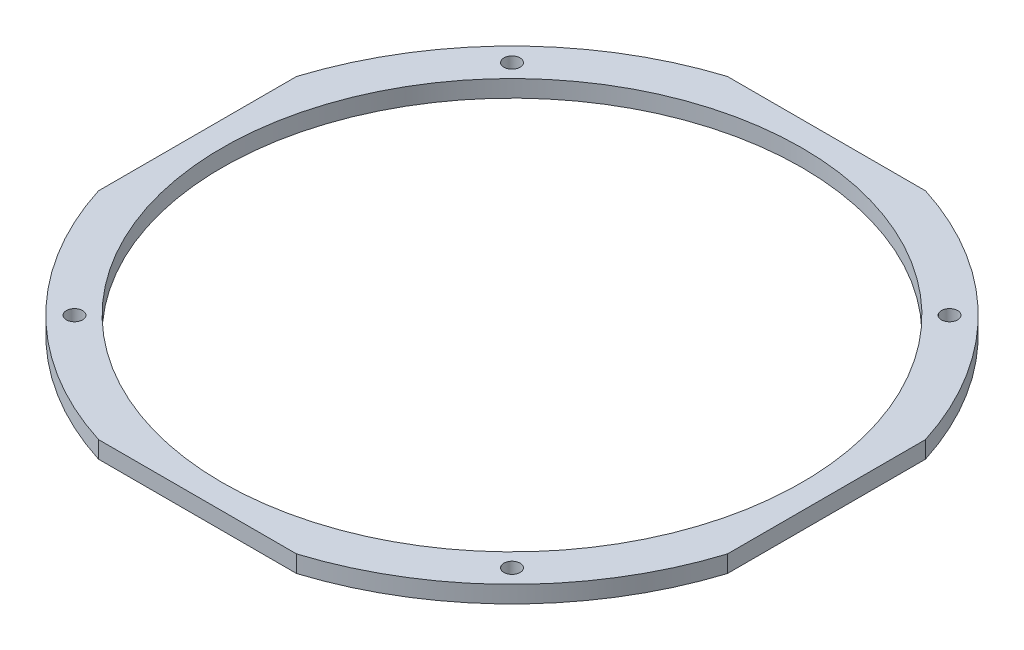
from build123d import *

# Parameters (mm, degrees)
SKETCH_1_R          = 65
SKETCH_1_R_2        = 57.15
EXTRUDE_1_DEPTH     = 3.35
SKETCH_2_W          = 162.249174321
SKETCH_2_H          = 152.83985105
SKETCH_2_W_2        = 124
SKETCH_2_H_2        = 124
CUT_EXTRUDE_1_DEPTH = 3.35
SKETCH_3_R          = 1.6
CUT_EXTRUDE_2_DEPTH = 3.35


with BuildPart() as part:
    # 草图1 → 凸台-拉伸1 (new body)
    with BuildSketch(Plane(origin=(0, 0, 0), x_dir=(1, 0, 0), z_dir=(0, 1, 0))):
        with Locations(Location((0, 0, 0), (0, 0, 270))):
            Circle(SKETCH_1_R)
        with Locations(Location((0, 0, 0), (0, 0, 270))):
            Circle(SKETCH_1_R_2, mode=Mode.SUBTRACT)
    extrude(amount=EXTRUDE_1_DEPTH)

    # 草图2 → 切除-拉伸1 (cut)
    with BuildSketch(Plane(origin=(0, 3.35, 0), x_dir=(1, 0, 0), z_dir=(0, 1, 0))):
        with Locations((0.017137102, 0)):
            Rectangle(SKETCH_2_W, SKETCH_2_H)
        Rectangle(SKETCH_2_W_2, SKETCH_2_H_2, mode=Mode.SUBTRACT)
    extrude(amount=-CUT_EXTRUDE_1_DEPTH, mode=Mode.SUBTRACT)

    # 草图3 → 切除-拉伸2 (cut)
    with BuildSketch(Plane(origin=(0, 3.35, 0), x_dir=(1, 0, 0), z_dir=(0, 1, 0))):
        with Locations(Location((43.133513652, -43.133513652, 0), (0, 0, 270))):
            Circle(SKETCH_3_R)
        with Locations(Location((-43.133513652, -43.133513652, 0), (0, 0, 270))):
            Circle(SKETCH_3_R)
        with Locations(Location((-43.133513652, 43.133513652, 0), (0, 0, 270))):
            Circle(SKETCH_3_R)
        with Locations(Location((43.133513652, 43.133513652, 0), (0, 0, 270))):
            Circle(SKETCH_3_R)
    extrude(amount=-CUT_EXTRUDE_2_DEPTH, mode=Mode.SUBTRACT)


solid = part.part
